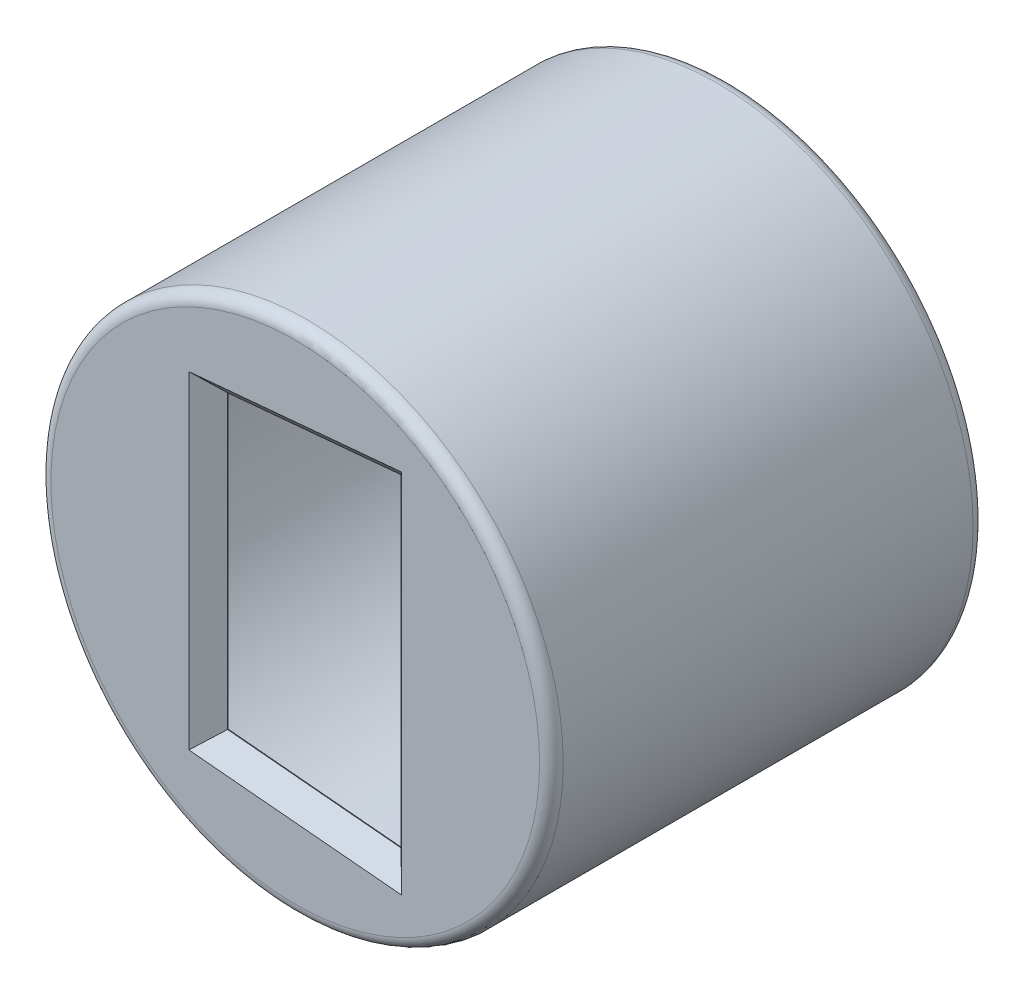
from build123d import *

# Parameters (mm, degrees)
SKETCH1_R           = 6.5
SKETCH1_R_2         = 6
BOSS_EXTRUDE1_DEPTH = 10
BOSS_EXTRUDE2_START = 0.5
SKETCH2_R           = 6.5
BOSS_EXTRUDE2_DEPTH = 0.5
SKETCH3_R           = 6.5
BOSS_EXTRUDE3_DEPTH = 0.5
CHAMFER1_SIZE       = 0.5
CHAMFER1_SIZE2      = 0.482844387
SKETCH4_W           = 2.9
SKETCH4_H           = 3.6
CUT_EXTRUDE1_DEPTH  = 1
FILLET1_R           = 0.1
FILLET2_R           = 0.3


with BuildPart() as part:
    # Sketch1 → Boss-Extrude1 (new body)
    with BuildSketch(Plane.XY):
        Circle(SKETCH1_R)
        Circle(SKETCH1_R_2, mode=Mode.SUBTRACT)
    extrude(amount=BOSS_EXTRUDE1_DEPTH)

    # Sketch2 → Boss-Extrude2 (add)
    with BuildSketch(Plane(origin=(0, 0, 0), x_dir=(-1, 0, 0), z_dir=(0, 0, -1)).offset(BOSS_EXTRUDE2_START)):
        Circle(SKETCH2_R)
    extrude(amount=-BOSS_EXTRUDE2_DEPTH)

    # Sketch3 → Boss-Extrude3 (add)
    with BuildSketch(Plane.XY.offset(10)):
        with Locations(Location((0, 0, 0), (0, 0, 180))):
            Circle(SKETCH3_R)
        Polygon((-2.2, 3.7), (-2.2, -3.7), (2.2, -4.1), (2.2, 4.1), align=None, mode=Mode.SUBTRACT)
    extrude(amount=BOSS_EXTRUDE3_DEPTH)

    # Chamfer1
    chamfer1_edges = [part.edges().sort_by_distance(p)[0] for p in [
        (0, -3.9, 10.5),
        (2.2, 0, 10.5),
        (0, 3.9, 10.5),
        (-2.2, 0, 10.5),
    ]]
    chamfer1_side = [part.faces().sort_by_distance(p)[0] for p in [
        (6.316152237, 0, 10.5),
    ]]
    chamfer(chamfer1_edges, length=CHAMFER1_SIZE, length2=CHAMFER1_SIZE2, reference=chamfer1_side[0])

    # Sketch4 → Cut-Extrude1 (cut)
    with BuildSketch(Plane(origin=(0, 0, -0.5), x_dir=(-1, 0, 0), z_dir=(0, 0, -1))):
        Rectangle(SKETCH4_W, SKETCH4_H)
    extrude(amount=-CUT_EXTRUDE1_DEPTH, mode=Mode.SUBTRACT)

    # Fillet1
    fillet1_edges = [part.edges().sort_by_distance(p)[0] for p in [
        (-1.45, 1.8, -0.25),
        (-1.45, -1.8, -0.25),
        (1.45, -1.8, -0.25),
        (1.45, 1.8, -0.25),
    ]]
    fillet(fillet1_edges, radius=FILLET1_R)

    # Fillet2
    fillet2_edges = [part.edges().sort_by_distance(p)[0] for p in [
        (6.5, 0, -0.5),
        (6.5, 0, 10.5),
    ]]
    fillet(fillet2_edges, radius=FILLET2_R)


solid = part.part
